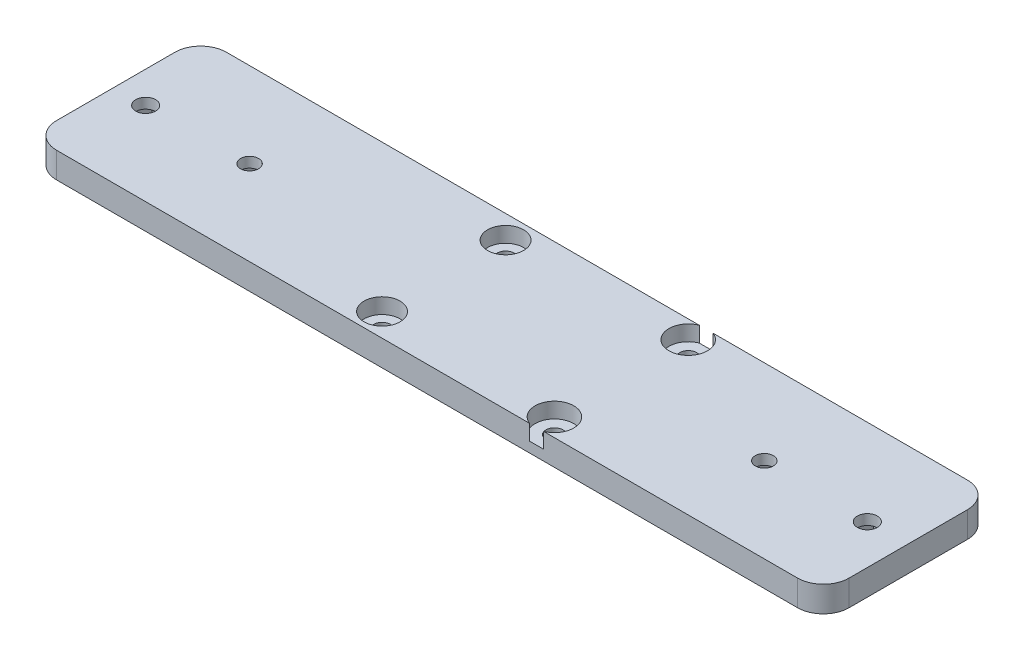
from build123d import *

# Parameters (mm, degrees)
SKETCH1_W           = 42
SKETCH1_H           = 33
BOSS_EXTRUDE1_DEPTH = 5
SKETCH2_W           = 33
SKETCH2_H           = 5
BOSS_EXTRUDE2_DEPTH = 60
SKETCH3_W           = 33
SKETCH3_H           = 5
BOSS_EXTRUDE3_DEPTH = 52
FILLET1_R           = 5
SKETCH6_R           = 1.933769561
SKETCH6_R_2         = 1.936009006
CUT_EXTRUDE1_DEPTH  = 55
SKETCH7_R           = 3.5
SKETCH7_R_2         = 1.65
SKETCH7_R_3         = 3.75
CUT_EXTRUDE6_DEPTH  = 3
SKETCH8_R           = 1.65
CUT_EXTRUDE7_DEPTH  = 9
CUT_EXTRUDE8_DEPTH  = 3


with BuildPart() as part:
    # Sketch1 → Boss-Extrude1 (new body)
    with BuildSketch(Plane(origin=(0, 0, 0), x_dir=(1, 0, 0), z_dir=(0, 1, 0))):
        with Locations((21, 16.5)):
            Rectangle(SKETCH1_W, SKETCH1_H)
    extrude(amount=BOSS_EXTRUDE1_DEPTH)

    # Sketch2 → Boss-Extrude2 (add)
    with BuildSketch(Plane.ZY):
        with Locations((-16.5, 2.5)):
            Rectangle(SKETCH2_W, SKETCH2_H)
    extrude(amount=BOSS_EXTRUDE2_DEPTH)

    # Sketch3 → Boss-Extrude3 (add)
    with BuildSketch(Plane(origin=(42, 0, 0), x_dir=(0, 0, -1), z_dir=(1, 0, 0))):
        with Locations((16.5, 2.5)):
            Rectangle(SKETCH3_W, SKETCH3_H)
    extrude(amount=BOSS_EXTRUDE3_DEPTH)

    # Fillet1
    fillet1_edges = [part.edges().sort_by_distance(p)[0] for p in [
        (-60, 2.5, -33),
        (94, 2.5, -33),
        (94, 2.5, 0),
        (-60, 2.5, 0),
    ]]
    fillet(fillet1_edges, radius=FILLET1_R)

    # Sketch6 → Cut-Extrude1 (cut)
    with BuildSketch(Plane(origin=(0, 5, 0), x_dir=(1, 0, 0), z_dir=(0, 1, 0))):
        with Locations((-53.892928071, 16.206648626)):
            Circle(SKETCH6_R)
        with BuildLine():
            Line((-33.231112903, 14.928003086), (-32.804010339, 15.222003341))
            ThreePointArc((-32.804010339, 15.222003341), (-32.373392107, 17.150567334), (-34.01401443, 18.251998007))
            ThreePointArc((-34.01401443, 18.251998007), (-35.37580525, 17.583221312), (-35.704007275, 16.101998866))
            ThreePointArc((-35.704007275, 16.101998866), (-34.750203351, 14.919643697), (-33.231112903, 14.928003086))
        make_face()
        with BuildLine():
            ThreePointArc((64.846014701, 15.211997211), (66.795875027, 14.926365069), (67.776015126, 16.636004329))
            ThreePointArc((67.776015126, 16.636004329), (66.782491719, 18.081747119), (65.034015201, 17.940004945))
            ThreePointArc((65.034015201, 17.940004945), (64.284233669, 16.621194208), (64.846014701, 15.211997211))
        make_face()
        with Locations((86.291564463, 16.259906017)):
            Circle(SKETCH6_R_2)
    extrude(amount=-CUT_EXTRUDE1_DEPTH, mode=Mode.SUBTRACT)

    # Sketch7 → Cut-Extrude6 (cut)
    # profile 1 of 4: a face of its own
    with BuildSketch(Plane(origin=(0, 5, 0), x_dir=(1, 0, 0), z_dir=(0, 1, 0))):
        with Locations((3.750000566, 28.5)):
            Circle(SKETCH7_R)
        with Locations((3.750000566, 28.5)):
            Circle(SKETCH7_R_2, mode=Mode.SUBTRACT)
    # profile 2 of 4: a face of its own
    with BuildSketch(Plane(origin=(0, 5, 0), x_dir=(1, 0, 0), z_dir=(0, 1, 0))):
        with Locations((3.750000566, 4.500000179)):
            Circle(SKETCH7_R)
        with Locations((3.750000566, 4.500000179)):
            Circle(SKETCH7_R_2, mode=Mode.SUBTRACT)
    # profile 3 of 4: a face of its own
    with BuildSketch(Plane(origin=(0, 5, 0), x_dir=(1, 0, 0), z_dir=(0, 1, 0))):
        with Locations((38.25, 3.500000179)):
            Circle(SKETCH7_R_3)
        with Locations((38.25, 3.500000179)):
            Circle(SKETCH7_R_2, mode=Mode.SUBTRACT)
    # profile 4 of 4: a face of its own
    with BuildSketch(Plane(origin=(0, 5, 0), x_dir=(1, 0, 0), z_dir=(0, 1, 0))):
        with Locations((38.25, 29.5)):
            Circle(SKETCH7_R_3)
        with Locations((38.25, 29.5)):
            Circle(SKETCH7_R_2, mode=Mode.SUBTRACT)
    extrude(amount=-CUT_EXTRUDE6_DEPTH, mode=Mode.SUBTRACT)

    # Sketch8 → Cut-Extrude7 (cut)
    with BuildSketch(Plane(origin=(0, 5, 0), x_dir=(1, 0, 0), z_dir=(0, 1, 0))):
        with Locations((38.25, 3.500000179)):
            Circle(SKETCH8_R)
        with Locations((3.750000566, 28.5)):
            Circle(SKETCH8_R)
        with Locations((3.750000566, 4.500000179)):
            Circle(SKETCH8_R)
        with Locations((38.25, 29.5)):
            Circle(SKETCH8_R)
    extrude(amount=-CUT_EXTRUDE7_DEPTH, mode=Mode.SUBTRACT)

    # Sketch9 → Cut-Extrude8 (cut)
    with BuildSketch(Plane.XZ):
        Polygon((-50.602031537, -16.206648626), (-52.247479804, -13.356648626), (-55.538376338, -13.356648626), (-57.183824606, -16.206648626), (-55.538376338, -19.056648626), (-52.247479804, -19.056648626), align=None)
        Polygon((-30.708442047, -16.501258638), (-32.353890314, -13.651258638), (-35.644786848, -13.651258638), (-37.290235116, -16.501258638), (-35.644786848, -19.351258638), (-32.353890314, -19.351258638), align=None)
        Polygon((69.321562817, -16.500838902), (67.67611455, -13.650838902), (64.385218016, -13.650838902), (62.739769748, -16.500838902), (64.385218016, -19.350838902), (67.67611455, -19.350838902), align=None)
        Polygon((89.582460998, -16.259906017), (87.93701273, -13.409906017), (84.646116196, -13.409906017), (83.000667929, -16.259906017), (84.646116196, -19.109906017), (87.93701273, -19.109906017), align=None)
    extrude(amount=-CUT_EXTRUDE8_DEPTH, mode=Mode.SUBTRACT)


solid = part.part
